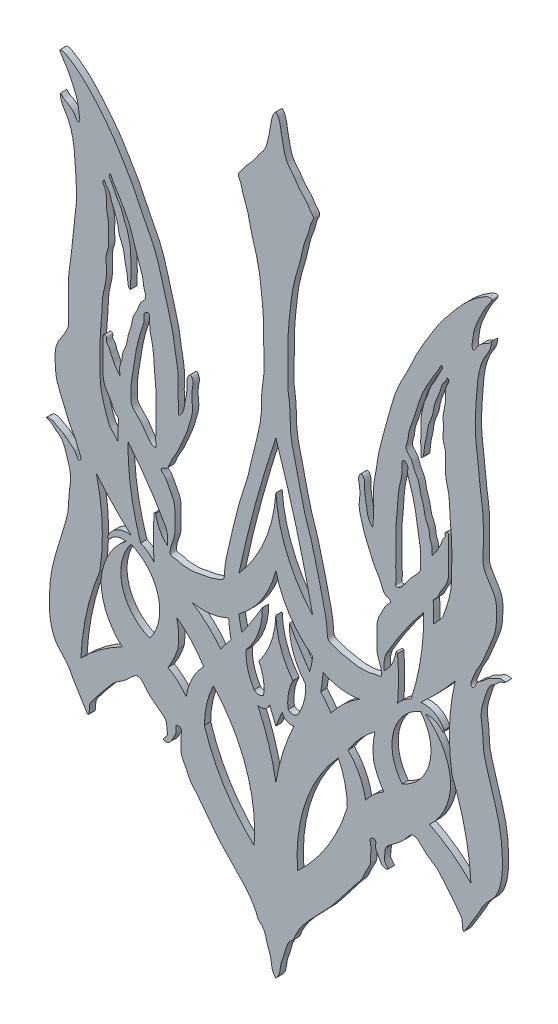
from build123d import *

# Parameters (mm, degrees)
EXTRUDE_1_DEPTH = 2


with BuildPart() as part:
    # Эскиз1 → Бобышка-Вытянуть1 (new body)
    with BuildSketch(Plane.XY):
        with BuildLine():
            add(Edge.make_bspline(
                [(82.102706904, 12.465712707), (79.934128093, 18.691354006), (72.206656751, 24.356943223), (65.918497526, 33.10588437), (62.550482526, 37.465996043), (60.179916269, 39.942968159), (59.155520242, 43.089687472), (57.264708953, 45.55429822), (57.628630909, 48.52246462), (57.236785944, 50.520090895), (57.918327201, 52.573547526), (56.949481536, 53.190898668), (55.486137253, 53.261442608), (56.248624437, 51.063367054), (55.189587263, 49.549777941), (54.503564767, 47.905129362), (53.407472102, 46.727866618), (51.103462148, 46.989369422), (53.44023714, 48.548852844), (52.904547898, 50.424822996), (53.131452474, 52.581881248), (50.26864093, 54.999563896), (47.207712996, 56.747675383), (43.741076142, 62.187345127), (40.130653769, 57.047818977), (36.356320523, 55.400304221), (34.012251799, 52.117452136), (31.623232267, 49.620761811), (29.919320448, 47.150544691), (28.313571634, 45.32395922), (28.36848946, 43.599012571), (28.091637993, 41.113186183), (25.483754696, 45.880540261), (23.670688836, 48.154141945), (21.350566635, 53.189299023), (17.594143928, 56.129367342), (15.614774515, 61.935969439), (15.509701932, 68.052495946), (15.974062902, 74.622119372), (17.288997238, 80.175771314), (19.033986167, 85.375987442), (20.313942729, 90.13813813), (21.772098305, 94.574702954), (21.640909556, 98.672124694), (22.333346542, 102.280552389), (22.463451194, 106.040269115), (21.255243106, 109.389637809), (20.433604075, 112.328133177), (19.176483756, 114.309044159), (17.336799707, 115.251982876), (16.615098073, 116.540771908), (13.950120436, 117.163747437), (16.659716844, 117.62326966), (18.015071214, 116.314339665), (20.286089261, 115.573312998), (22.002900596, 113.68918319), (23.905953937, 112.885675539), (24.701065454, 110.168648837), (25.946171233, 111.22713053), (24.803488365, 113.231499667), (24.159004748, 115.771585471), (22.112188185, 118.606813953), (20.894565281, 121.986655775), (19.332245419, 125.544094157), (17.61293454, 129.508882085), (17.445766618, 134.004593355), (17.295673224, 140.091249603), (22.050469394, 144.124045231), (21.641578372, 148.977355585), (21.793499453, 153.625896298), (21.481057883, 159.107634232), (22.643207064, 165.812624247), (23.19945889, 173.134545738), (24.623195094, 181.974832319), (23.764973514, 191.528128022), (23.391778237, 198.890464825), (20.936164491, 204.28459093), (19.450269933, 205.963536491), (18.857521278, 209.389315731), (19.958637944, 207.742827963), (21.391891915, 207.262421519), (22.924676266, 206.034722082), (23.877434844, 204.82086223), (24.73216968, 203.165344754), (25.414268093, 204.436242291), (24.973050226, 205.961668667), (24.871133354, 208.351513328), (23.804283236, 211.584746414), (22.002596781, 215.268157424), (20.775935879, 217.63575357), (18.333576452, 220.788706436), (20.165741753, 220.669056747), (22.063706415, 219.680933264), (26.785983707, 216.375695397), (31.421091599, 210.912443201), (35.950418589, 205.249141244), (38.604693804, 200.796796286), (41.071660977, 196.805428345), (43.4657229, 192.474542465), (45.578615411, 187.376284313), (48.79698689, 182.01664615), (50.848489274, 175.811610585), (52.397148923, 169.504924944), (54.090415777, 164.071278975), (55.185276219, 159.456113542), (55.694374123, 154.689564501), (56.835146275, 150.29599233), (56.435375834, 145.892310548), (56.569836807, 142.495216191), (56.767389027, 140.6512339), (56.642912451, 138.453467643), (58.436375905, 140.408684679), (58.512493234, 143.216427311), (59.763915489, 147.302744692), (59.134872117, 150.611297236), (60.545994443, 151.93023562), (61.606205983, 150.380175362), (60.978296603, 148.284338973), (60.819523091, 145.609480348), (61.420616359, 142.037973598), (60.335465599, 138.749870984), (59.348206818, 135.212271141), (57.899698265, 132.294512134), (56.574184982, 128.465191269), (54.250580068, 125.532651757), (53.370757572, 122.08603674), (51.717621418, 121.914661181), (50.820487567, 120.947363243), (52.671117541, 119.716629098), (53.466341574, 117.430537316), (55.187680157, 114.98021349), (55.635828859, 111.914956012), (55.473854795, 109.145296034), (55.62925853, 106.27599063), (55.21892172, 103.832972287), (54.37566949, 101.951415054), (54.072943072, 100.476451046), (53.846702729, 98.758921668), (56.029686234, 98.844343744), (57.618869295, 98.152810718), (59.689616976, 98.072876982), (61.878811837, 98.046832285), (64.29396772, 98.704306359), (67.035007986, 98.986206079), (69.132036507, 99.891683362), (71.139451373, 100.547172585), (71.288333965, 102.132005395), (71.384574908, 103.979973472), (71.684250814, 106.432646841), (72.31650941, 109.060200003), (72.968373607, 111.840296495), (73.727874143, 115.395888025), (74.853632648, 119.492588981), (75.762956478, 123.572746377), (76.965244839, 127.247056929), (78.225899736, 131.044714828), (79.343051387, 135.050309578), (80.76144832, 142.472381486), (83.428171637, 150.139729759), (82.951178024, 158.30664186), (84.010686667, 163.2854313), (83.58998191, 169.659696544), (84.055891296, 177.574946216), (83.048209317, 185.69948224), (82.347589953, 192.100704806), (80.988601161, 196.906974825), (79.568944378, 201.511652436), (78.863305319, 206.146347854), (77.049347212, 209.857568315), (76.688997618, 212.632412409), (75.257477167, 214.611686106), (76.835847058, 216.124492939), (77.879019848, 218.252220653), (80.403353358, 220.256989932), (81.81630872, 223.04756287), (84.119404801, 225.309721874), (85.047736825, 228.279888013), (85.611720311, 231.045705069), (86.182525905, 234.196110101), (86.389566494, 236.550690383), (87.644341315, 237.790830774)],
                knots=[0, 0, 0, 0, 0.028657806, 0.043274885, 0.049533704, 0.054227818, 0.058819034, 0.064724401, 0.06765679, 0.072055375, 0.074743399, 0.075624472, 0.077090667, 0.080033221, 0.082665121, 0.085727016, 0.088170674, 0.089898601, 0.093084742, 0.095039668, 0.098737594, 0.102370353, 0.110881161, 0.116931375, 0.125339831, 0.130965554, 0.136850662, 0.143264974, 0.146930461, 0.150997519, 0.153453365, 0.155706306, 0.158835715, 0.16914552, 0.17505594, 0.182848873, 0.190744573, 0.202253139, 0.211080801, 0.221099799, 0.228519833, 0.236407968, 0.243940693, 0.249861412, 0.255134568, 0.260931786, 0.266943465, 0.271401337, 0.275061824, 0.277427164, 0.280410891, 0.282800686, 0.284651115, 0.288472218, 0.292183535, 0.295167262, 0.299831928, 0.30258361, 0.303471409, 0.305901416, 0.311305272, 0.316550173, 0.321490611, 0.327908743, 0.334557956, 0.341171665, 0.348631286, 0.361774883, 0.365299781, 0.370587127, 0.383408238, 0.390433811, 0.401952356, 0.417350992, 0.431601838, 0.445958658, 0.451732779, 0.457128495, 0.459446136, 0.461226598, 0.462918296, 0.467114883, 0.469213177, 0.471365846, 0.472355609, 0.474351747, 0.4788029, 0.483184266, 0.490226065, 0.49634359, 0.499773835, 0.500927896, 0.503187828, 0.510201435, 0.526825033, 0.536330674, 0.543637136, 0.550744283, 0.558020553, 0.566469279, 0.576205631, 0.58678661, 0.596488111, 0.606229403, 0.613082952, 0.618339385, 0.628410908, 0.633616635, 0.638970976, 0.643136513, 0.644482817, 0.645853527, 0.651354478, 0.65947052, 0.66475003, 0.665493402, 0.66717546, 0.670743645, 0.675955737, 0.679240061, 0.687367824, 0.691400521, 0.696250622, 0.702416207, 0.70970946, 0.714482943, 0.715763003, 0.717201291, 0.719145234, 0.723693501, 0.729034014, 0.732428285, 0.737793994, 0.74186051, 0.745653622, 0.74917068, 0.751124036, 0.753034612, 0.755611318, 0.758771488, 0.761604115, 0.764924757, 0.768896162, 0.773112355, 0.777416655, 0.779907741, 0.781699252, 0.784111682, 0.788712959, 0.792961697, 0.796625502, 0.801900437, 0.809759425, 0.816250701, 0.821199048, 0.827609274, 0.834746342, 0.840381714, 0.862553491, 0.87148197, 0.877812273, 0.885899759, 0.900819775, 0.914378989, 0.923642761, 0.930510989, 0.937411123, 0.945888108, 0.952109934, 0.955979797, 0.959296768, 0.961171761, 0.965010951, 0.970487215, 0.975504726, 0.979300788, 0.985169634, 0.989420302, 0.992410948, 1, 1, 1, 1], degree=3))
            add(Edge.make_bspline(
                [(82.102706904, 12.465712707), (84.299261435, 11.039965057), (84.489754926, 7.817104662), (86.512692357, 3.372538928), (86.161432371, 0.555560607), (87.644341315, -0.751846469)],
                knots=[0, 0, 0, 0, 0.459954652, 0.64060061, 1, 1, 1, 1], degree=3))
            add(Edge.make_bspline(
                [(93.185975726, 12.465712707), (90.989421196, 11.039965057), (90.798927705, 7.817104662), (88.775990273, 3.372538928), (89.12725026, 0.555560607), (87.644341315, -0.751846469)],
                knots=[0, 0, 0, 0, 0.459954652, 0.64060061, 1, 1, 1, 1], degree=3))
            add(Edge.make_bspline(
                [(93.185975726, 12.465712707), (95.354554537, 18.691354006), (103.082025879, 24.356943223), (109.370185105, 33.10588437), (112.738200104, 37.465996043), (115.108766362, 39.942968159), (116.133162389, 43.089687472), (118.023973677, 45.55429822), (117.660051722, 48.52246462), (118.051896687, 50.520090895), (117.37035543, 52.573547526), (118.339201094, 53.190898668), (119.802545378, 53.261442608), (119.040058194, 51.063367054), (120.099095367, 49.549777941), (120.785117864, 47.905129362), (121.881210529, 46.727866618), (124.185220482, 46.989369422), (121.84844549, 48.548852844), (122.384134732, 50.424822996), (122.157230156, 52.581881248), (125.0200417, 54.999563896), (128.080969634, 56.747675383), (131.547606488, 62.187345127), (135.158028862, 57.047818977), (138.932362107, 55.400304221), (141.276430832, 52.117452136), (143.665450363, 49.620761811), (145.369362183, 47.150544691), (146.975110997, 45.32395922), (146.920193171, 43.599012571), (147.197044637, 41.113186183), (149.804927934, 45.880540261), (151.617993795, 48.154141945), (153.938115996, 53.189299023), (157.694538703, 56.129367342), (159.673908116, 61.935969439), (159.778980698, 68.052495946), (159.314619729, 74.622119372), (157.999685392, 80.175771314), (156.254696464, 85.375987442), (154.974739901, 90.13813813), (153.516584326, 94.574702954), (153.647773074, 98.672124694), (152.955336089, 102.280552389), (152.825231437, 106.040269115), (154.033439524, 109.389637809), (154.855078556, 112.328133177), (156.112198875, 114.309044159), (157.951882924, 115.251982876), (158.673584557, 116.540771908), (161.338562195, 117.163747437), (158.628965786, 117.62326966), (157.273611417, 116.314339665), (155.002593369, 115.573312998), (153.285782035, 113.68918319), (151.382728694, 112.885675539), (150.587617176, 110.168648837), (149.342511398, 111.22713053), (150.485194266, 113.231499667), (151.129677883, 115.771585471), (153.176494445, 118.606813953), (154.394117349, 121.986655775), (155.956437211, 125.544094157), (157.675748091, 129.508882085), (157.842916012, 134.004593355), (157.993009407, 140.091249603), (153.238213237, 144.124045231), (153.647104259, 148.977355585), (153.495183178, 153.625896298), (153.807624748, 159.107634232), (152.645475566, 165.812624247), (152.089223741, 173.134545738), (150.665487537, 181.974832319), (151.523709117, 191.528128022), (151.896904394, 198.890464825), (154.352518139, 204.28459093), (155.838412697, 205.963536491), (156.431161352, 209.389315731), (155.330044687, 207.742827963), (153.896790716, 207.262421519), (152.364006365, 206.034722082), (151.411247786, 204.82086223), (150.556512951, 203.165344754), (149.874414538, 204.436242291), (150.315632405, 205.961668667), (150.417549276, 208.351513328), (151.484399395, 211.584746414), (153.286085849, 215.268157424), (154.512746751, 217.63575357), (156.955106179, 220.788706436), (155.122940877, 220.669056747), (153.224976216, 219.680933264), (148.502698924, 216.375695397), (143.867591032, 210.912443201), (139.338264042, 205.249141244), (136.683988827, 200.796796286), (134.217021654, 196.805428345), (131.822959731, 192.474542465), (129.710067219, 187.376284313), (126.491695741, 182.01664615), (124.440193357, 175.811610585), (122.891533707, 169.504924944), (121.198266854, 164.071278975), (120.103406412, 159.456113542), (119.594308508, 154.689564501), (118.453536356, 150.29599233), (118.853306797, 145.892310548), (118.718845824, 142.495216191), (118.521293604, 140.6512339), (118.645770179, 138.453467643), (116.852306726, 140.408684679), (116.776189396, 143.216427311), (115.524767141, 147.302744692), (116.153810513, 150.611297236), (114.742688188, 151.93023562), (113.682476648, 150.380175362), (114.310386028, 148.284338973), (114.46915954, 145.609480348), (113.868066271, 142.037973598), (114.953217031, 138.749870984), (115.940475812, 135.212271141), (117.388984365, 132.294512134), (118.714497649, 128.465191269), (121.038102562, 125.532651757), (121.917925059, 122.08603674), (123.571061212, 121.914661181), (124.468195064, 120.947363243), (122.617565089, 119.716629098), (121.822341057, 117.430537316), (120.101002474, 114.98021349), (119.652853772, 111.914956012), (119.814827836, 109.145296034), (119.659424101, 106.27599063), (120.06976091, 103.832972287), (120.91301314, 101.951415054), (121.215739559, 100.476451046), (121.441979902, 98.758921668), (119.258996396, 98.844343744), (117.669813336, 98.152810718), (115.599065655, 98.072876982), (113.409870793, 98.046832285), (110.994714911, 98.704306359), (108.253674645, 98.986206079), (106.156646124, 99.891683362), (104.149231258, 100.547172585), (104.000348666, 102.132005395), (103.904107722, 103.979973472), (103.604431816, 106.432646841), (102.972173221, 109.060200003), (102.320309023, 111.840296495), (101.560808488, 115.395888025), (100.435049982, 119.492588981), (99.525726153, 123.572746377), (98.323437791, 127.247056929), (97.062782895, 131.044714828), (95.945631244, 135.050309578), (94.52723431, 142.472381486), (91.860510994, 150.139729759), (92.337504606, 158.30664186), (91.277995964, 163.2854313), (91.69870072, 169.659696544), (91.232791334, 177.574946216), (92.240473314, 185.69948224), (92.941092678, 192.100704806), (94.300081469, 196.906974825), (95.719738253, 201.511652436), (96.425377311, 206.146347854), (98.239335418, 209.857568315), (98.599685013, 212.632412409), (100.031205464, 214.611686106), (98.452835572, 216.124492939), (97.409662783, 218.252220653), (94.885329272, 220.256989932), (93.47237391, 223.04756287), (91.16927783, 225.309721874), (90.240945806, 228.279888013), (89.67696232, 231.045705069), (89.106156726, 234.196110101), (88.899116137, 236.550690383), (87.644341315, 237.790830774)],
                knots=[0, 0, 0, 0, 0.028657806, 0.043274885, 0.049533704, 0.054227818, 0.058819034, 0.064724401, 0.06765679, 0.072055375, 0.074743399, 0.075624472, 0.077090667, 0.080033221, 0.082665121, 0.085727016, 0.088170674, 0.089898601, 0.093084742, 0.095039668, 0.098737594, 0.102370353, 0.110881161, 0.116931375, 0.125339831, 0.130965554, 0.136850662, 0.143264974, 0.146930461, 0.150997519, 0.153453365, 0.155706306, 0.158835715, 0.16914552, 0.17505594, 0.182848873, 0.190744573, 0.202253139, 0.211080801, 0.221099799, 0.228519833, 0.236407968, 0.243940693, 0.249861412, 0.255134568, 0.260931786, 0.266943465, 0.271401337, 0.275061824, 0.277427164, 0.280410891, 0.282800686, 0.284651115, 0.288472218, 0.292183535, 0.295167262, 0.299831928, 0.30258361, 0.303471409, 0.305901416, 0.311305272, 0.316550173, 0.321490611, 0.327908743, 0.334557956, 0.341171665, 0.348631286, 0.361774883, 0.365299781, 0.370587127, 0.383408238, 0.390433811, 0.401952356, 0.417350992, 0.431601838, 0.445958658, 0.451732779, 0.457128495, 0.459446136, 0.461226598, 0.462918296, 0.467114883, 0.469213177, 0.471365846, 0.472355609, 0.474351747, 0.4788029, 0.483184266, 0.490226065, 0.49634359, 0.499773835, 0.500927896, 0.503187828, 0.510201435, 0.526825033, 0.536330674, 0.543637136, 0.550744283, 0.558020553, 0.566469279, 0.576205631, 0.58678661, 0.596488111, 0.606229403, 0.613082952, 0.618339385, 0.628410908, 0.633616635, 0.638970976, 0.643136513, 0.644482817, 0.645853527, 0.651354478, 0.65947052, 0.66475003, 0.665493402, 0.66717546, 0.670743645, 0.675955737, 0.679240061, 0.687367824, 0.691400521, 0.696250622, 0.702416207, 0.70970946, 0.714482943, 0.715763003, 0.717201291, 0.719145234, 0.723693501, 0.729034014, 0.732428285, 0.737793994, 0.74186051, 0.745653622, 0.74917068, 0.751124036, 0.753034612, 0.755611318, 0.758771488, 0.761604115, 0.764924757, 0.768896162, 0.773112355, 0.777416655, 0.779907741, 0.781699252, 0.784111682, 0.788712959, 0.792961697, 0.796625502, 0.801900437, 0.809759425, 0.816250701, 0.821199048, 0.827609274, 0.834746342, 0.840381714, 0.862553491, 0.87148197, 0.877812273, 0.885899759, 0.900819775, 0.914378989, 0.923642761, 0.930510989, 0.937411123, 0.945888108, 0.952109934, 0.955979797, 0.959296768, 0.961171761, 0.965010951, 0.970487215, 0.975504726, 0.979300788, 0.985169634, 0.989420302, 0.992410948, 1, 1, 1, 1], degree=3))
        make_face()
        with BuildLine():
            ThreePointArc((67.78082661, 69.825446008), (78.18669601, 52.385818173), (80.737859658, 32.23850319))
            ThreePointArc((80.737859658, 32.23850319), (71.167526321, 43.824204758), (64.928847204, 57.49529264))
            ThreePointArc((64.928847204, 57.49529264), (65.651131531, 63.82313723), (67.78082661, 69.825446008))
        make_face(mode=Mode.SUBTRACT)
        with BuildLine():
            ThreePointArc((38.786154146, 66.005613686), (31.791690984, 61.723135956), (25.608077579, 56.335645289))
            ThreePointArc((25.608077579, 56.335645289), (27.498083085, 70.019259509), (31.637921053, 83.197846707))
            ThreePointArc((31.637921053, 83.197846707), (32.414176861, 96.469809629), (30.580634822, 109.637409884))
            ThreePointArc((30.580634822, 109.637409884), (35.895253965, 103.705922992), (41.61812339, 98.16728788))
            ThreePointArc((41.61812339, 98.16728788), (37.207078366, 97.475801687), (34.171940559, 94.201139895))
            ThreePointArc((34.171940559, 94.201139895), (34.240749121, 93.777390393), (34.589040269, 93.526409247))
            ThreePointArc((34.589040269, 93.526409247), (36.994402324, 95.382134908), (40.014802939, 95.708730185))
            ThreePointArc((40.014802939, 95.708730185), (34.48727228, 89.281193647), (32.043398941, 81.163662973))
            ThreePointArc((32.043398941, 81.163662973), (33.769645371, 72.852834615), (38.786154146, 66.005613686))
        make_face(mode=Mode.SUBTRACT)
        with BuildLine():
            ThreePointArc((47.509430651, 72.781480245), (38.786154146, 82.76050712), (41.61812339, 95.708730185))
            ThreePointArc((41.61812339, 95.708730185), (50.25104013, 85.706484776), (47.509430651, 72.781480245))
        make_face(mode=Mode.SUBTRACT)
        with BuildLine():
            ThreePointArc((44.646881664, 97.53162248), (41.55869541, 110.352657161), (40.620714556, 123.506972671))
            ThreePointArc((40.620714556, 123.506972671), (46.973616548, 115.089338891), (52.555938808, 106.142071132))
            ThreePointArc((52.555938808, 106.142071132), (53.195305583, 103.658922697), (53.164458139, 101.09496785))
            ThreePointArc((53.164458139, 101.09496785), (50.671674465, 104.296020655), (49.463400588, 108.169105183))
            ThreePointArc((49.463400588, 108.169105183), (49.1926685, 108.078505136), (48.935018992, 107.955537812))
            ThreePointArc((48.935018992, 107.955537812), (48.65065167, 101.078333028), (48.935300605, 94.201139895))
            ThreePointArc((48.935300605, 94.201139895), (47.031599545, 96.176066285), (44.646881664, 97.53162248))
        make_face(mode=Mode.SUBTRACT)
        with BuildLine():
            ThreePointArc((56.108384596, 82.845962464), (60.834261147, 78.585776038), (64.682165911, 73.518555252))
            ThreePointArc((64.682165911, 73.518555252), (61.041725308, 68.438701437), (59.118823877, 62.492259422))
            ThreePointArc((59.118823877, 62.492259422), (56.48094396, 65.35561463), (53.334779442, 67.648835581))
            ThreePointArc((53.334779442, 67.648835581), (55.141782302, 70.845361635), (56.48094396, 74.264379652))
            ThreePointArc((56.48094396, 74.264379652), (56.719176075, 78.57360074), (56.108384596, 82.845962464))
        make_face(mode=Mode.SUBTRACT)
        with BuildLine():
            ThreePointArc((60.950868678, 89.398303594), (66.921100086, 89.208987685), (72.643625203, 90.921357351))
            ThreePointArc((72.643625203, 90.921357351), (72.922032494, 88.05407347), (73.392696837, 85.212013909))
            ThreePointArc((73.392696837, 85.212013909), (71.665567765, 83.152207991), (70.075824211, 80.984607777))
            ThreePointArc((70.075824211, 80.984607777), (65.920974873, 85.633543368), (60.950868678, 89.398303594))
        make_face(mode=Mode.SUBTRACT)
        with BuildLine():
            Line((85.654622356, 73.518555252), (87.644341315, 68.631836287))
            Line((87.644341315, 68.631836287), (89.634060275, 73.518555252))
            ThreePointArc((89.634060275, 73.518555252), (91.114550915, 71.742497029), (93.417278699, 71.533499188))
            ThreePointArc((93.417278699, 71.533499188), (89.89826095, 62.506177968), (87.644341315, 53.083022414))
            ThreePointArc((87.644341315, 53.083022414), (85.390421681, 62.506177968), (81.871403931, 71.533499188))
            ThreePointArc((81.871403931, 71.533499188), (84.174131715, 71.742497029), (85.654622356, 73.518555252))
        make_face(mode=Mode.SUBTRACT)
        with BuildLine():
            ThreePointArc((75.910198282, 93.621563357), (83.344724887, 101.53309463), (87.644341315, 111.501936665))
            ThreePointArc((87.644341315, 111.501936665), (91.943957743, 101.53309463), (99.378484349, 93.621563357))
            ThreePointArc((99.378484349, 93.621563357), (98.984918721, 91.298886219), (98.420170657, 89.011795795))
            ThreePointArc((98.420170657, 89.011795795), (95.080741051, 93.995254805), (91.943957743, 99.108692422))
            ThreePointArc((91.943957743, 99.108692422), (93.205914897, 91.504419236), (97.142419068, 84.877093874))
            ThreePointArc((97.142419068, 84.877093874), (96.589400408, 79.832741703), (94.550822973, 75.18564363))
            ThreePointArc((94.550822973, 75.18564363), (93.037278065, 74.558712802), (91.523733157, 75.18564363))
            ThreePointArc((91.523733157, 75.18564363), (91.632133599, 79.608912752), (93.037278065, 83.804461513))
            ThreePointArc((93.037278065, 83.804461513), (89.134582416, 91.059957215), (87.644341315, 99.162576093))
            ThreePointArc((87.644341315, 99.162576093), (86.154100215, 91.059957215), (82.251404566, 83.804461513))
            ThreePointArc((82.251404566, 83.804461513), (83.656549032, 79.608912752), (83.764949474, 75.18564363))
            ThreePointArc((83.764949474, 75.18564363), (82.251404566, 74.558712802), (80.737859658, 75.18564363))
            ThreePointArc((80.737859658, 75.18564363), (78.699282223, 79.832741703), (78.146263562, 84.877093874))
            ThreePointArc((78.146263562, 84.877093874), (82.082767734, 91.504419236), (83.344724887, 99.108692422))
            ThreePointArc((83.344724887, 99.108692422), (80.207941579, 93.995254805), (76.868511973, 89.011795795))
            ThreePointArc((76.868511973, 89.011795795), (76.30376391, 91.298886219), (75.910198282, 93.621563357))
        make_face(mode=Mode.SUBTRACT)
        with BuildLine():
            ThreePointArc((110.359835426, 57.49529264), (104.12115631, 43.824204758), (94.550822973, 32.23850319))
            ThreePointArc((94.550822973, 32.23850319), (97.10198662, 52.385818173), (107.507856021, 69.825446008))
            ThreePointArc((107.507856021, 69.825446008), (109.6375511, 63.82313723), (110.359835426, 57.49529264))
        make_face(mode=Mode.SUBTRACT)
        with BuildLine():
            ThreePointArc((116.169858754, 62.492259422), (114.246957322, 68.438701437), (110.60651672, 73.518555252))
            ThreePointArc((110.60651672, 73.518555252), (114.454421483, 78.585776038), (119.180298034, 82.845962464))
            ThreePointArc((119.180298034, 82.845962464), (118.569506556, 78.57360074), (118.807738671, 74.264379652))
            ThreePointArc((118.807738671, 74.264379652), (120.146900329, 70.845361635), (121.953903189, 67.648835581))
            ThreePointArc((121.953903189, 67.648835581), (118.807738671, 65.35561463), (116.169858754, 62.492259422))
        make_face(mode=Mode.SUBTRACT)
        with BuildLine():
            ThreePointArc((102.645057428, 90.921357351), (108.367582544, 89.208987685), (114.337813953, 89.398303594))
            ThreePointArc((114.337813953, 89.398303594), (109.367707758, 85.633543368), (105.21285842, 80.984607777))
            ThreePointArc((105.21285842, 80.984607777), (103.623114865, 83.152207991), (101.895985793, 85.212013909))
            ThreePointArc((101.895985793, 85.212013909), (102.366650137, 88.05407347), (102.645057428, 90.921357351))
        make_face(mode=Mode.SUBTRACT)
        with BuildLine():
            ThreePointArc((127.779251979, 72.781480245), (125.0376425, 85.706484776), (133.670559241, 95.708730185))
            ThreePointArc((133.670559241, 95.708730185), (136.502528485, 82.76050712), (127.779251979, 72.781480245))
        make_face(mode=Mode.SUBTRACT)
        with BuildLine():
            ThreePointArc((140.699642362, 93.526409247), (141.047933509, 93.777390393), (141.116742072, 94.201139895))
            ThreePointArc((141.116742072, 94.201139895), (138.081604265, 97.475801687), (133.670559241, 98.16728788))
            ThreePointArc((133.670559241, 98.16728788), (139.393428666, 103.705922992), (144.708047808, 109.637409884))
            ThreePointArc((144.708047808, 109.637409884), (142.874505769, 96.469809629), (143.650761578, 83.197846707))
            ThreePointArc((143.650761578, 83.197846707), (147.790599546, 70.019259509), (149.680605052, 56.335645289))
            ThreePointArc((149.680605052, 56.335645289), (143.496991647, 61.723135956), (136.502528485, 66.005613686))
            ThreePointArc((136.502528485, 66.005613686), (141.51903726, 72.852834615), (143.245283689, 81.163662973))
            ThreePointArc((143.245283689, 81.163662973), (140.801410351, 89.281193647), (135.273879692, 95.708730185))
            ThreePointArc((135.273879692, 95.708730185), (138.294280306, 95.382134908), (140.699642362, 93.526409247))
        make_face(mode=Mode.SUBTRACT)
        with BuildLine():
            ThreePointArc((126.353382025, 94.201139895), (126.63803096, 101.078333028), (126.353663639, 107.955537812))
            ThreePointArc((126.353663639, 107.955537812), (126.09601413, 108.078505136), (125.825282042, 108.169105183))
            ThreePointArc((125.825282042, 108.169105183), (124.617008166, 104.296020655), (122.124224491, 101.09496785))
            ThreePointArc((122.124224491, 101.09496785), (122.093377047, 103.658922697), (122.732743823, 106.142071132))
            ThreePointArc((122.732743823, 106.142071132), (128.315066083, 115.089338891), (134.667968074, 123.506972671))
            ThreePointArc((134.667968074, 123.506972671), (133.729987221, 110.352657161), (130.641800966, 97.53162248))
            ThreePointArc((130.641800966, 97.53162248), (128.257083085, 96.176066285), (126.353382025, 94.201139895))
        make_face(mode=Mode.SUBTRACT)
        with BuildLine():
            add(Edge.make_bspline(
                [(46.962921027, 162.143713435), (46.59238338, 162.155954543), (45.296593782, 161.274242832), (45.963997186, 159.565079549), (45.325104724, 157.695869069), (44.475728341, 155.198903904), (43.554879602, 151.868713632), (42.754940636, 147.538026184), (42.244671782, 143.414613006), (41.541026483, 139.972235951), (41.615673253, 137.712398313), (41.653585942, 136.128382109), (41.494274303, 134.633037769), (42.359341032, 133.227220911), (43.859580219, 131.854839623), (45.23880325, 130.390062756), (46.167413877, 128.824167574), (47.18791135, 127.473711033), (48.047007127, 126.26650077), (49.778577568, 126.122101893), (49.32029559, 127.974156321), (49.521784027, 129.772340766), (49.531352998, 132.968927187), (49.4171688, 136.545058542), (49.561295176, 140.511560447), (49.421439163, 144.401250857), (48.897982621, 148.033967315), (48.831370971, 151.508157568), (48.241370706, 155.333757825), (47.268627976, 158.075382676), (47.646331701, 162.121136232), (46.962921027, 162.143713435)],
                knots=[0, 0, 0, 0, 0.019516273, 0.041316196, 0.063925165, 0.095285818, 0.145724082, 0.19917943, 0.268237851, 0.309127466, 0.336563805, 0.356607304, 0.371755516, 0.394271425, 0.417403403, 0.45247545, 0.472503898, 0.48857829, 0.519640596, 0.527249238, 0.545926867, 0.569891117, 0.608526648, 0.666292084, 0.712585252, 0.763868208, 0.819279522, 0.856004163, 0.901668733, 0.964004658, 1, 1, 1, 1], degree=3))
        make_face(mode=Mode.SUBTRACT)
        with BuildLine():
            add(Edge.make_bspline(
                [(32.708801856, 191.404882594), (32.446081869, 190.835826189), (33.607273191, 189.487977852), (33.81826916, 187.257121602), (33.591240356, 184.19133693), (34.768014441, 180.82865434), (34.142041615, 177.364293115), (34.737502424, 174.21837232), (33.415993196, 171.435235481), (33.916028215, 167.464924745), (33.641941384, 163.667189395), (32.42601977, 159.640863682), (32.40193501, 155.010196735), (31.906263558, 150.214532619), (31.621061718, 145.523765416), (31.677265073, 141.735098348), (31.717175131, 137.723257905), (31.90024248, 133.629970589), (32.978019044, 129.78831796), (33.966706976, 126.741540333), (34.773855458, 124.63729902), (35.947679194, 123.602708087), (36.530025576, 122.864782966), (37.545410851, 121.587912173), (37.42172196, 123.189175973), (37.566605671, 124.640192835), (37.372427625, 126.681322912), (37.822912444, 128.53065759), (36.059662425, 129.583533822), (35.483971721, 131.914354876), (33.825059661, 133.802254413), (32.998783759, 135.867128102), (32.57751566, 137.899463484), (32.748356029, 140.168315561), (32.696896633, 142.664710199), (32.720422226, 145.35026905), (32.679371262, 147.101829414), (32.747247036, 149.47417735), (34.035626737, 148.872506175), (33.448440426, 147.600463304), (34.783428844, 146.645409185), (34.96016133, 145.108285078), (35.839739957, 143.837703832), (36.376204602, 142.248078327), (37.329948887, 141.446055238), (38.268841699, 139.669211475), (37.616934524, 143.025157718), (38.815207738, 144.439268363), (38.703454757, 147.231254027), (40.265251199, 149.548745778), (40.451507689, 152.700197148), (41.854881774, 155.642266015), (41.985901517, 158.86197187), (43.852037446, 161.217053332), (44.276783764, 163.886335986), (46.849693832, 165.649439201), (45.52600668, 168.176003151), (45.539311483, 170.868425347), (44.289774704, 173.694479283), (43.408279882, 176.792805476), (42.360474509, 179.749400246), (41.258736202, 183.317913542), (39.688394672, 186.496956499), (37.987435845, 189.08147429), (37.102155307, 190.973649143), (35.97078551, 192.408340366), (35.545956473, 193.416020724), (34.964379898, 194.607161561), (34.480962898, 193.584019003), (35.060558865, 192.970855878), (35.498440729, 191.957822878), (36.191545449, 190.584249682), (37.11494923, 188.653491466), (38.657177881, 186.629188581), (39.179675924, 184.138335725), (40.380193457, 181.939468483), (40.956518235, 179.589821278), (41.489870513, 177.044296872), (41.498152886, 174.380706639), (41.505467149, 171.851044799), (41.667907898, 169.141043731), (41.29690491, 167.727735445), (41.597781689, 165.516934695), (40.813405133, 166.030064238), (40.574474892, 166.86141956), (40.522400503, 168.21287224), (40.278544129, 170.281766637), (39.501264658, 172.782870692), (39.378089981, 175.917924834), (37.670198397, 178.786527538), (37.442824032, 182.003194932), (36.374318223, 184.70945259), (35.243877398, 187.115878817), (34.79036616, 189.637499682), (33.485359193, 190.566352529), (33.149204887, 192.036066449), (32.783927437, 191.567606008), (32.708801856, 191.404882594)],
                knots=[0, 0, 0, 0, 0.007255235, 0.01971827, 0.029693411, 0.047671667, 0.065407416, 0.075397938, 0.089085435, 0.104150683, 0.127415769, 0.13915542, 0.159577724, 0.188219618, 0.203162289, 0.221785611, 0.238383652, 0.256377594, 0.275817921, 0.290943209, 0.298886473, 0.305591647, 0.30987133, 0.315048472, 0.316265706, 0.327772809, 0.336578432, 0.343480918, 0.349934775, 0.360303265, 0.374097281, 0.382593951, 0.389485079, 0.401439173, 0.412377599, 0.423035184, 0.435397983, 0.44122698, 0.444335047, 0.448491364, 0.455752305, 0.462248022, 0.468296897, 0.476115643, 0.483190051, 0.486815732, 0.495399255, 0.506277859, 0.515894827, 0.529177327, 0.542231743, 0.556627879, 0.571941797, 0.583258139, 0.59498748, 0.60703281, 0.616793862, 0.627412351, 0.643129936, 0.656673919, 0.670278681, 0.684630431, 0.706115689, 0.717022039, 0.72540686, 0.734132438, 0.739584646, 0.743025839, 0.745433311, 0.749877888, 0.753370609, 0.760138317, 0.770209992, 0.781746599, 0.793286465, 0.80330675, 0.814727553, 0.825140421, 0.837743596, 0.849666251, 0.859355463, 0.8715062, 0.875734017, 0.877717505, 0.88085976, 0.887377799, 0.895398075, 0.908474438, 0.921917573, 0.936195624, 0.951394693, 0.963938329, 0.974273499, 0.987387616, 0.994239006, 0.997925343, 1, 1, 1, 1], degree=3))
        make_face(mode=Mode.SUBTRACT)
        with BuildLine():
            ThreePointArc((87.644341315, 132.860292833), (84.118417763, 117.892428675), (75.910198282, 104.888805053))
            ThreePointArc((75.910198282, 104.888805053), (81.149794041, 126.61690118), (87.644341315, 148.003447902))
            ThreePointArc((87.644341315, 148.003447902), (94.138888589, 126.61690118), (99.378484349, 104.888805053))
            ThreePointArc((99.378484349, 104.888805053), (91.170264867, 117.892428675), (87.644341315, 132.860292833))
        make_face(mode=Mode.SUBTRACT)
        with BuildLine():
            add(Edge.make_bspline(
                [(128.325761603, 162.143713435), (128.696299251, 162.155954543), (129.992088849, 161.274242832), (129.324685445, 159.565079549), (129.963577906, 157.695869069), (130.812954289, 155.198903904), (131.733803029, 151.868713632), (132.533741994, 147.538026184), (133.044010848, 143.414613006), (133.747656148, 139.972235951), (133.673009377, 137.712398313), (133.635096688, 136.128382109), (133.794408327, 134.633037769), (132.929341599, 133.227220911), (131.429102411, 131.854839623), (130.049879381, 130.390062756), (129.121268754, 128.824167574), (128.10077128, 127.473711033), (127.241675503, 126.26650077), (125.510105063, 126.122101893), (125.96838704, 127.974156321), (125.766898604, 129.772340766), (125.757329632, 132.968927187), (125.871513831, 136.545058542), (125.727387454, 140.511560447), (125.867243468, 144.401250857), (126.390700009, 148.033967315), (126.457311659, 151.508157568), (127.047311924, 155.333757825), (128.020054654, 158.075382676), (127.642350929, 162.121136232), (128.325761603, 162.143713435)],
                knots=[0, 0, 0, 0, 0.019516273, 0.041316196, 0.063925165, 0.095285818, 0.145724082, 0.19917943, 0.268237851, 0.309127466, 0.336563805, 0.356607304, 0.371755516, 0.394271425, 0.417403403, 0.45247545, 0.472503898, 0.48857829, 0.519640596, 0.527249238, 0.545926867, 0.569891117, 0.608526648, 0.666292084, 0.712585252, 0.763868208, 0.819279522, 0.856004163, 0.901668733, 0.964004658, 1, 1, 1, 1], degree=3))
        make_face(mode=Mode.SUBTRACT)
        with BuildLine():
            add(Edge.make_bspline(
                [(142.579880775, 191.404882594), (142.842600762, 190.835826189), (141.68140944, 189.487977852), (141.470413471, 187.257121602), (141.697442275, 184.19133693), (140.52066819, 180.82865434), (141.146641016, 177.364293115), (140.551180207, 174.21837232), (141.872689435, 171.435235481), (141.372654415, 167.464924745), (141.646741247, 163.667189395), (142.86266286, 159.640863682), (142.886747621, 155.010196735), (143.382419072, 150.214532619), (143.667620913, 145.523765416), (143.611417558, 141.735098348), (143.571507499, 137.723257905), (143.388440151, 133.629970589), (142.310663587, 129.78831796), (141.321975654, 126.741540333), (140.514827173, 124.63729902), (139.341003437, 123.602708087), (138.758657055, 122.864782966), (137.74327178, 121.587912173), (137.86696067, 123.189175973), (137.72207696, 124.640192835), (137.916255005, 126.681322912), (137.465770187, 128.53065759), (139.229020206, 129.583533822), (139.80471091, 131.914354876), (141.463622969, 133.802254413), (142.289898872, 135.867128102), (142.711166971, 137.899463484), (142.540326602, 140.168315561), (142.591785998, 142.664710199), (142.568260404, 145.35026905), (142.609311368, 147.101829414), (142.541435595, 149.47417735), (141.253055894, 148.872506175), (141.840242204, 147.600463304), (140.505253786, 146.645409185), (140.328521301, 145.108285078), (139.448942674, 143.837703832), (138.912478028, 142.248078327), (137.958733743, 141.446055238), (137.019840932, 139.669211475), (137.671748106, 143.025157718), (136.473474893, 144.439268363), (136.585227873, 147.231254027), (135.023431431, 149.548745778), (134.837174942, 152.700197148), (133.433800857, 155.642266015), (133.302781114, 158.86197187), (131.436645185, 161.217053332), (131.011898867, 163.886335986), (128.438988798, 165.649439201), (129.762675951, 168.176003151), (129.749371147, 170.868425347), (130.998907927, 173.694479283), (131.880402748, 176.792805476), (132.928208122, 179.749400246), (134.029946429, 183.317913542), (135.600287959, 186.496956499), (137.301246785, 189.08147429), (138.186527324, 190.973649143), (139.317897121, 192.408340366), (139.742726158, 193.416020724), (140.324302732, 194.607161561), (140.807719733, 193.584019003), (140.228123765, 192.970855878), (139.790241901, 191.957822878), (139.097137182, 190.584249682), (138.1737334, 188.653491466), (136.63150475, 186.629188581), (136.109006706, 184.138335725), (134.908489174, 181.939468483), (134.332164396, 179.589821278), (133.798812117, 177.044296872), (133.790529745, 174.380706639), (133.783215482, 171.851044799), (133.620774733, 169.141043731), (133.991777721, 167.727735445), (133.690900941, 165.516934695), (134.475277498, 166.030064238), (134.714207739, 166.86141956), (134.766282127, 168.21287224), (135.010138502, 170.281766637), (135.787417972, 172.782870692), (135.91059265, 175.917924834), (137.618484233, 178.786527538), (137.845858599, 182.003194932), (138.914364407, 184.70945259), (140.044805232, 187.115878817), (140.498316471, 189.637499682), (141.803323437, 190.566352529), (142.139477744, 192.036066449), (142.504755193, 191.567606008), (142.579880775, 191.404882594)],
                knots=[0, 0, 0, 0, 0.007255235, 0.01971827, 0.029693411, 0.047671667, 0.065407416, 0.075397938, 0.089085435, 0.104150683, 0.127415769, 0.13915542, 0.159577724, 0.188219618, 0.203162289, 0.221785611, 0.238383652, 0.256377594, 0.275817921, 0.290943209, 0.298886473, 0.305591647, 0.30987133, 0.315048472, 0.316265706, 0.327772809, 0.336578432, 0.343480918, 0.349934775, 0.360303265, 0.374097281, 0.382593951, 0.389485079, 0.401439173, 0.412377599, 0.423035184, 0.435397983, 0.44122698, 0.444335047, 0.448491364, 0.455752305, 0.462248022, 0.468296897, 0.476115643, 0.483190051, 0.486815732, 0.495399255, 0.506277859, 0.515894827, 0.529177327, 0.542231743, 0.556627879, 0.571941797, 0.583258139, 0.59498748, 0.60703281, 0.616793862, 0.627412351, 0.643129936, 0.656673919, 0.670278681, 0.684630431, 0.706115689, 0.717022039, 0.72540686, 0.734132438, 0.739584646, 0.743025839, 0.745433311, 0.749877888, 0.753370609, 0.760138317, 0.770209992, 0.781746599, 0.793286465, 0.80330675, 0.814727553, 0.825140421, 0.837743596, 0.849666251, 0.859355463, 0.8715062, 0.875734017, 0.877717505, 0.88085976, 0.887377799, 0.895398075, 0.908474438, 0.921917573, 0.936195624, 0.951394693, 0.963938329, 0.974273499, 0.987387616, 0.994239006, 0.997925343, 1, 1, 1, 1], degree=3))
        make_face(mode=Mode.SUBTRACT)
    extrude(amount=EXTRUDE_1_DEPTH)


solid = part.part
